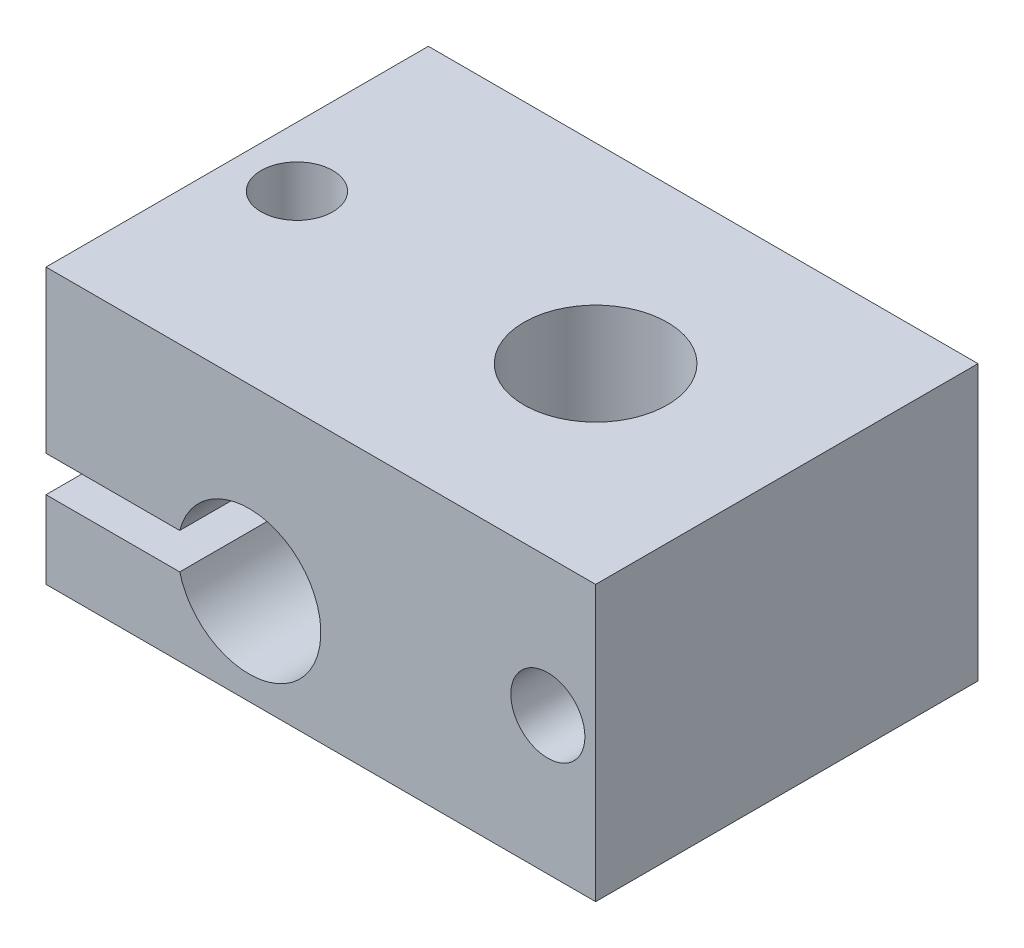
from build123d import *

# Parameters (mm, degrees)
SKETCH_1_R          = 1.55
EXTRUDE_2_DEPTH     = 16
SKETCH_2_R          = 1.5
SKETCH_2_R_2        = 3
CUT_EXTRUDE_1_DEPTH = 25.289710071
SKETCH_3_R          = 1.5
CUT_EXTRUDE_2_DEPTH = 4


with BuildPart() as part:
    # 草图1 → 凸台-拉伸2 (new body)
    with BuildSketch(Plane.XY):
        with BuildLine():
            Line((14.20352123, 6.683160013), (-8.79647877, 6.683160013))
            Line((-8.79647877, 6.683160013), (-8.79647877, -0.066839987))
            Line((-8.79647877, -0.066839987), (-3.20121628, -0.066839987))
            ThreePointArc((-3.20121628, -0.066839987), (2.70352123, -0.816839987), (-3.20121628, -1.566839987))
            Line((-3.20121628, -1.566839987), (-8.79647877, -1.566839987))
            Line((-8.79647877, -1.566839987), (-8.79647877, -4.816839987))
            Line((-8.79647877, -4.816839987), (14.20352123, -4.816839987))
            Line((14.20352123, -4.816839987), (14.20352123, 6.683160013))
        make_face()
        with Locations((12.20352123, 0.933160013)):
            Circle(SKETCH_1_R, mode=Mode.SUBTRACT)
    extrude(amount=EXTRUDE_2_DEPTH)

    # 草图2 → 切除-拉伸1 (cut, through all)
    with BuildSketch(Plane(origin=(0, 6.683160013, 0), x_dir=(1, 0, 0), z_dir=(0, 1, 0))):
        with Locations(Location((-6.29647877, -8, 0), (0, 0, 180))):
            Circle(SKETCH_2_R)
        with Locations(Location((6.20352123, -8, 0), (0, 0, 180))):
            Circle(SKETCH_2_R_2)
    extrude(amount=-CUT_EXTRUDE_1_DEPTH, mode=Mode.SUBTRACT)

    # 草图3 → 切除-拉伸2 (cut)
    with BuildSketch(Plane.XZ.offset(4.816839987)):
        with Locations((12.20352123, 8)):
            Circle(SKETCH_3_R)
    extrude(amount=-CUT_EXTRUDE_2_DEPTH, mode=Mode.SUBTRACT)


solid = part.part
